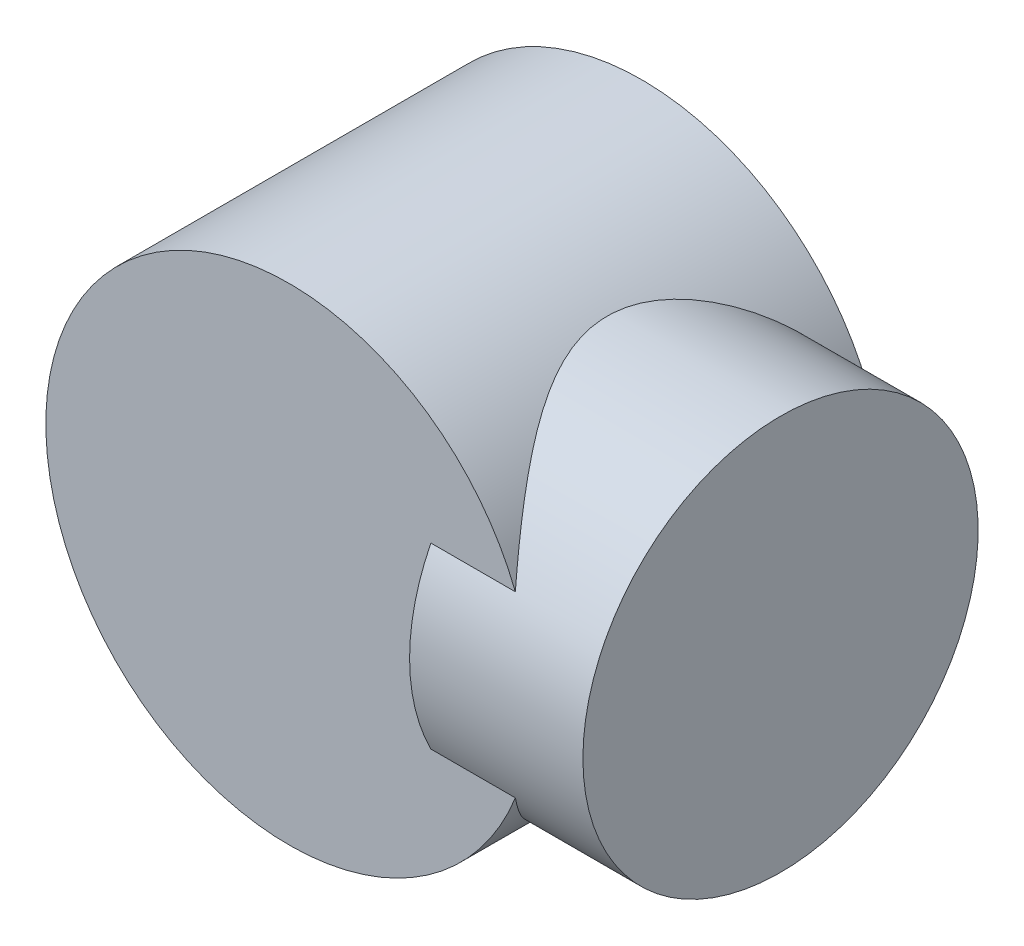
from build123d import *

# Parameters (mm, degrees)
SCHIZZO2_R = 40
BASE_DEPTH = 29


with BuildPart() as part:
    # Schizzo2 → Base (new, symmetric)
    with BuildSketch(Plane.XY):
        with Locations(Location((0, 0, 0), (0, 0, 180))):
            Circle(SCHIZZO2_R)
    extrude(amount=BASE_DEPTH, both=True)

    # Schizzo3 → Rivoluzione1 (revolve)
    with BuildSketch(Plane.XY, mode=Mode.PRIVATE) as rivoluzione1_sk:
        with BuildLine():
            Line((40, 0), (51.818447633, 0))
            Line((51.818447633, 0), (51.818447633, -32.5))
            Line((51.818447633, -32.5), (23.318447633, -32.5))
            ThreePointArc((23.318447633, -32.5), (35.586078074, -18.265569998), (40, 0))
        make_face()
    revolve(rivoluzione1_sk.sketch.rotate(Axis((-78.446809676, 0, 0), (1, 0, 0)), 270), axis=Axis((-78.446809676, 0, 0), (1, 0, 0)))


solid = part.part
